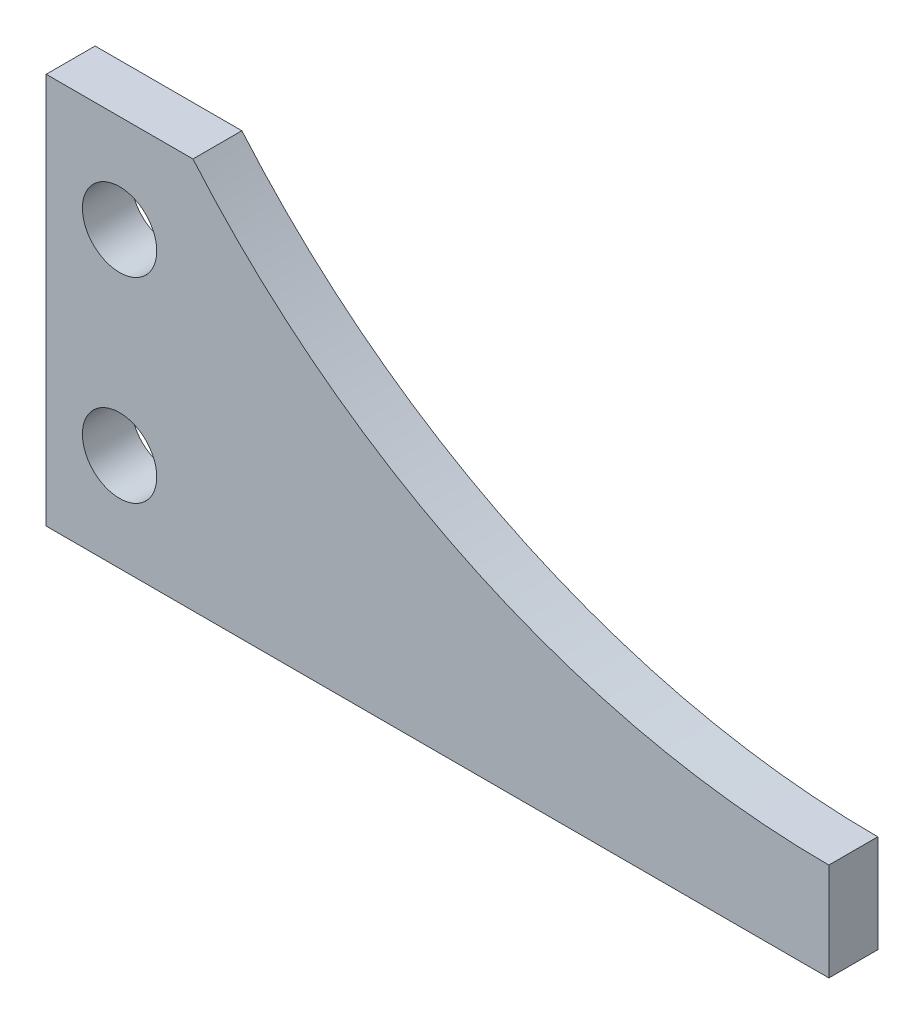
from build123d import *

# Parameters (mm, degrees)
SKETCH1_R           = 2.413
BOSS_EXTRUDE1_DEPTH = 3.175


with BuildPart() as part:
    # Sketch1 → Boss-Extrude1 (new body)
    with BuildSketch(Plane.XY):
        with BuildLine():
            Line((0, 0), (0, 25.4))
            Line((0, 25.4), (9.525, 25.4))
            ThreePointArc((9.525, 25.4), (28.070459062, 11.342244634), (50.8, 6.35))
            Line((50.8, 6.35), (50.8, 0))
            Line((50.8, 0), (0, 0))
        make_face()
        with Locations((4.7625, 6.35)):
            Circle(SKETCH1_R, mode=Mode.SUBTRACT)
        with Locations((4.7625, 19.05)):
            Circle(SKETCH1_R, mode=Mode.SUBTRACT)
    extrude(amount=BOSS_EXTRUDE1_DEPTH)


solid = part.part
